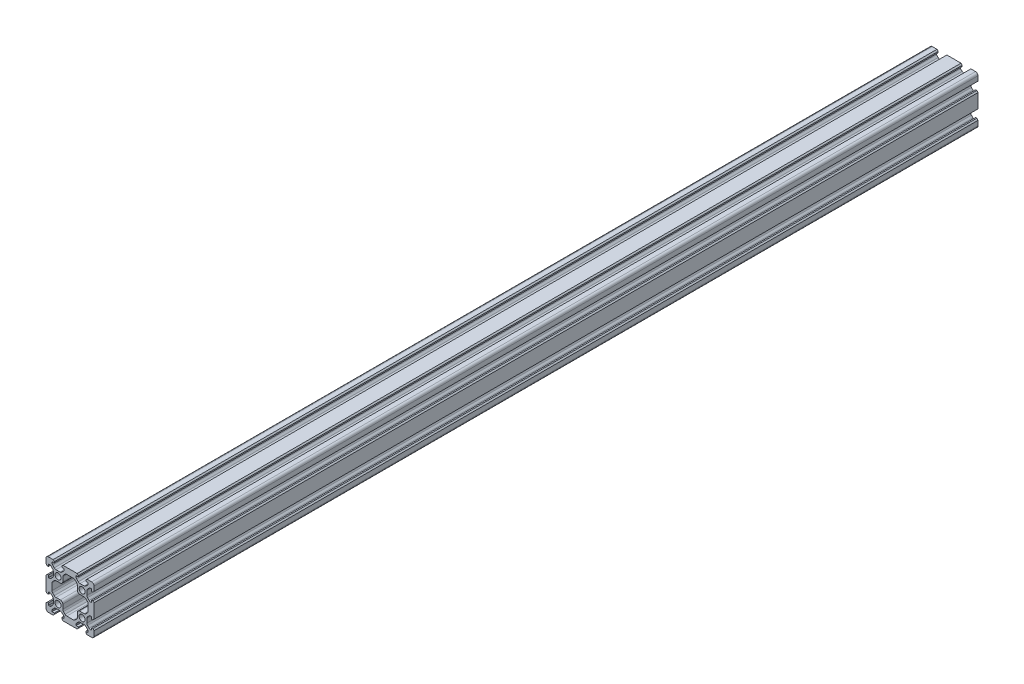
from build123d import *

# Parameters (mm, degrees)
SKETCH1_R           = 2.5
BOSS_EXTRUDE1_DEPTH = 735


with BuildPart() as part:
    # Sketch1 → Boss-Extrude1 (new body)
    with BuildSketch(Plane.XY):
        with BuildLine():
            Line((-13.1, -19), (-14.1, -20))
            Line((-14.1, -20), (-18, -20))
            ThreePointArc((-18, -20), (-19.414213562, -19.414213562), (-20, -18))
            Line((-20, -18), (-20, -14.1))
            Line((-20, -14.1), (-19, -13.1))
            Line((-19, -13.1), (-18, -13.1))
            Line((-18, -13.1), (-18, -15))
            Line((-18, -15), (-17.242640687, -15))
            ThreePointArc((-17.242640687, -15), (-16.477273822, -14.847759065), (-15.828427125, -14.414213562))
            Line((-15.828427125, -14.414213562), (-14.537854624, -13.123641061))
            ThreePointArc((-14.537854624, -13.123641061), (-14.104309121, -12.474794364), (-13.952068186, -11.709427499))
            Line((-13.952068186, -11.709427499), (-13.952068186, -8.290572501))
            ThreePointArc((-13.952068186, -8.290572501), (-14.104309121, -7.525205636), (-14.537854624, -6.876358939))
            Line((-14.537854624, -6.876358939), (-15.828427125, -5.585786438))
            ThreePointArc((-15.828427125, -5.585786438), (-16.477273822, -5.152240935), (-17.242640687, -5))
            Line((-17.242640687, -5), (-18, -5))
            Line((-18, -5), (-18, -6.9))
            Line((-18, -6.9), (-19, -6.9))
            Line((-19, -6.9), (-20, -5.9))
            Line((-20, -5.9), (-20, 5.9))
            Line((-20, 5.9), (-19, 6.9))
            Line((-19, 6.9), (-18, 6.9))
            Line((-18, 6.9), (-18, 5))
            Line((-18, 5), (-17.242640687, 5))
            ThreePointArc((-17.242640687, 5), (-16.477273822, 5.152240935), (-15.828427125, 5.585786438))
            Line((-15.828427125, 5.585786438), (-14.537854624, 6.876358939))
            ThreePointArc((-14.537854624, 6.876358939), (-14.104309121, 7.525205636), (-13.952068186, 8.290572501))
            Line((-13.952068186, 8.290572501), (-13.952068186, 11.709427499))
            ThreePointArc((-13.952068186, 11.709427499), (-14.104309121, 12.474794364), (-14.537854624, 13.123641061))
            Line((-14.537854624, 13.123641061), (-15.828427125, 14.414213562))
            ThreePointArc((-15.828427125, 14.414213562), (-16.477273822, 14.847759065), (-17.242640687, 15))
            Line((-17.242640687, 15), (-18, 15))
            Line((-18, 15), (-18, 13.1))
            Line((-18, 13.1), (-19, 13.1))
            Line((-19, 13.1), (-20, 14.1))
            Line((-20, 14.1), (-20, 18))
            ThreePointArc((-20, 18), (-19.414213562, 19.414213562), (-18, 20))
            Line((-18, 20), (-14.1, 20))
            Line((-14.1, 20), (-13.1, 19))
            Line((-13.1, 19), (-13.1, 18))
            Line((-13.1, 18), (-15, 18))
            Line((-15, 18), (-15, 17.242640687))
            ThreePointArc((-15, 17.242640687), (-14.847759065, 16.477273822), (-14.414213562, 15.828427125))
            Line((-14.414213562, 15.828427125), (-13.123641061, 14.537854624))
            ThreePointArc((-13.123641061, 14.537854624), (-12.474794364, 14.104309121), (-11.709427499, 13.952068186))
            Line((-11.709427499, 13.952068186), (-8.290572501, 13.952068186))
            ThreePointArc((-8.290572501, 13.952068186), (-7.525205636, 14.104309121), (-6.876358939, 14.537854624))
            Line((-6.876358939, 14.537854624), (-5.585786438, 15.828427125))
            ThreePointArc((-5.585786438, 15.828427125), (-5.152240935, 16.477273822), (-5, 17.242640687))
            Line((-5, 17.242640687), (-5, 18))
            Line((-5, 18), (-6.9, 18))
            Line((-6.9, 18), (-6.9, 19))
            Line((-6.9, 19), (-5.9, 20))
            Line((-5.9, 20), (5.9, 20))
            Line((5.9, 20), (6.9, 19))
            Line((6.9, 19), (6.9, 18))
            Line((6.9, 18), (5, 18))
            Line((5, 18), (5, 17.242640687))
            ThreePointArc((5, 17.242640687), (5.152240935, 16.477273822), (5.585786438, 15.828427125))
            Line((5.585786438, 15.828427125), (6.876358939, 14.537854624))
            ThreePointArc((6.876358939, 14.537854624), (7.525205636, 14.104309121), (8.290572501, 13.952068186))
            Line((8.290572501, 13.952068186), (11.709427499, 13.952068186))
            ThreePointArc((11.709427499, 13.952068186), (12.474794364, 14.104309121), (13.123641061, 14.537854624))
            Line((13.123641061, 14.537854624), (14.414213562, 15.828427125))
            ThreePointArc((14.414213562, 15.828427125), (14.847759065, 16.477273822), (15, 17.242640687))
            Line((15, 17.242640687), (15, 18))
            Line((15, 18), (13.1, 18))
            Line((13.1, 18), (13.1, 19))
            Line((13.1, 19), (14.1, 20))
            Line((14.1, 20), (18, 20))
            ThreePointArc((18, 20), (19.414213562, 19.414213562), (20, 18))
            Line((20, 18), (20, 14.1))
            Line((20, 14.1), (19, 13.1))
            Line((19, 13.1), (18, 13.1))
            Line((18, 13.1), (18, 15))
            Line((18, 15), (17.242640687, 15))
            ThreePointArc((17.242640687, 15), (16.477273822, 14.847759065), (15.828427125, 14.414213562))
            Line((15.828427125, 14.414213562), (14.537854624, 13.123641061))
            ThreePointArc((14.537854624, 13.123641061), (14.104309121, 12.474794364), (13.952068186, 11.709427499))
            Line((13.952068186, 11.709427499), (13.952068186, 8.290572501))
            ThreePointArc((13.952068186, 8.290572501), (14.104309121, 7.525205636), (14.537854624, 6.876358939))
            Line((14.537854624, 6.876358939), (15.828427125, 5.585786438))
            ThreePointArc((15.828427125, 5.585786438), (16.477273822, 5.152240935), (17.242640687, 5))
            Line((17.242640687, 5), (18, 5))
            Line((18, 5), (18, 6.9))
            Line((18, 6.9), (19, 6.9))
            Line((19, 6.9), (20, 5.9))
            Line((20, 5.9), (20, -5.9))
            Line((20, -5.9), (19, -6.9))
            Line((19, -6.9), (18, -6.9))
            Line((18, -6.9), (18, -5))
            Line((18, -5), (17.242640687, -5))
            ThreePointArc((17.242640687, -5), (16.477273822, -5.152240935), (15.828427125, -5.585786438))
            Line((15.828427125, -5.585786438), (14.537854624, -6.876358939))
            ThreePointArc((14.537854624, -6.876358939), (14.104309121, -7.525205636), (13.952068186, -8.290572501))
            Line((13.952068186, -8.290572501), (13.952068186, -11.709427499))
            ThreePointArc((13.952068186, -11.709427499), (14.104309121, -12.474794364), (14.537854624, -13.123641061))
            Line((14.537854624, -13.123641061), (15.828427125, -14.414213562))
            ThreePointArc((15.828427125, -14.414213562), (16.477273822, -14.847759065), (17.242640687, -15))
            Line((17.242640687, -15), (18, -15))
            Line((18, -15), (18, -13.1))
            Line((18, -13.1), (19, -13.1))
            Line((19, -13.1), (20, -14.1))
            Line((20, -14.1), (20, -18))
            ThreePointArc((20, -18), (19.414213562, -19.414213562), (18, -20))
            Line((18, -20), (14.1, -20))
            Line((14.1, -20), (13.1, -19))
            Line((13.1, -19), (13.1, -18))
            Line((13.1, -18), (15, -18))
            Line((15, -18), (15, -17.242640687))
            ThreePointArc((15, -17.242640687), (14.847759065, -16.477273822), (14.414213562, -15.828427125))
            Line((14.414213562, -15.828427125), (13.123641061, -14.537854624))
            ThreePointArc((13.123641061, -14.537854624), (12.474794364, -14.104309121), (11.709427499, -13.952068186))
            Line((11.709427499, -13.952068186), (8.290572501, -13.952068186))
            ThreePointArc((8.290572501, -13.952068186), (7.525205636, -14.104309121), (6.876358939, -14.537854624))
            Line((6.876358939, -14.537854624), (5.585786438, -15.828427125))
            ThreePointArc((5.585786438, -15.828427125), (5.152240935, -16.477273822), (5, -17.242640687))
            Line((5, -17.242640687), (5, -18))
            Line((5, -18), (6.9, -18))
            Line((6.9, -18), (6.9, -19))
            Line((6.9, -19), (5.9, -20))
            Line((5.9, -20), (-5.9, -20))
            Line((-5.9, -20), (-6.9, -19))
            Line((-6.9, -19), (-6.9, -18))
            Line((-6.9, -18), (-5, -18))
            Line((-5, -18), (-5, -17.242640687))
            ThreePointArc((-5, -17.242640687), (-5.152240935, -16.477273822), (-5.585786438, -15.828427125))
            Line((-5.585786438, -15.828427125), (-6.876358939, -14.537854624))
            ThreePointArc((-6.876358939, -14.537854624), (-7.525205636, -14.104309121), (-8.290572501, -13.952068186))
            Line((-8.290572501, -13.952068186), (-11.709427499, -13.952068186))
            ThreePointArc((-11.709427499, -13.952068186), (-12.474794364, -14.104309121), (-13.123641061, -14.537854624))
            Line((-13.123641061, -14.537854624), (-14.414213562, -15.828427125))
            ThreePointArc((-14.414213562, -15.828427125), (-14.847759065, -16.477273822), (-15, -17.242640687))
            Line((-15, -17.242640687), (-15, -18))
            Line((-15, -18), (-13.1, -18))
            Line((-13.1, -18), (-13.1, -19))
        make_face()
        with Locations((-10, -10)):
            Circle(SKETCH1_R, mode=Mode.SUBTRACT)
        with Locations((-10, 10)):
            Circle(SKETCH1_R, mode=Mode.SUBTRACT)
        with Locations((10, 10)):
            Circle(SKETCH1_R, mode=Mode.SUBTRACT)
        with Locations((10, -10)):
            Circle(SKETCH1_R, mode=Mode.SUBTRACT)
        with BuildLine():
            Line((-4.171572875, -14.414213562), (-5.462145376, -13.123641061))
            ThreePointArc((-5.462145376, -13.123641061), (-5.895690879, -12.474794364), (-6.047931814, -11.709427499))
            Line((-6.047931814, -11.709427499), (-6.047931814, -8.047931814))
            ThreePointArc((-6.047931814, -8.047931814), (-6.633718252, -6.633718252), (-8.047931814, -6.047931814))
            Line((-8.047931814, -6.047931814), (-11.709427499, -6.047931814))
            ThreePointArc((-11.709427499, -6.047931814), (-12.474794364, -5.895690879), (-13.123641061, -5.462145376))
            Line((-13.123641061, -5.462145376), (-14.414213562, -4.171572875))
            ThreePointArc((-14.414213562, -4.171572875), (-14.847759065, -3.522726178), (-15, -2.757359313))
            Line((-15, -2.757359313), (-15, 2.757359313))
            ThreePointArc((-15, 2.757359313), (-14.847759065, 3.522726178), (-14.414213562, 4.171572875))
            Line((-14.414213562, 4.171572875), (-13.123641061, 5.462145376))
            ThreePointArc((-13.123641061, 5.462145376), (-12.474794364, 5.895690879), (-11.709427499, 6.047931814))
            Line((-11.709427499, 6.047931814), (-8.047931814, 6.047931814))
            ThreePointArc((-8.047931814, 6.047931814), (-6.633718252, 6.633718252), (-6.047931814, 8.047931814))
            Line((-6.047931814, 8.047931814), (-6.047931814, 11.709427499))
            ThreePointArc((-6.047931814, 11.709427499), (-5.895690879, 12.474794364), (-5.462145376, 13.123641061))
            Line((-5.462145376, 13.123641061), (-4.171572875, 14.414213562))
            ThreePointArc((-4.171572875, 14.414213562), (-3.522726178, 14.847759065), (-2.757359313, 15))
            Line((-2.757359313, 15), (2.757359313, 15))
            ThreePointArc((2.757359313, 15), (3.522726178, 14.847759065), (4.171572875, 14.414213562))
            Line((4.171572875, 14.414213562), (5.462145376, 13.123641061))
            ThreePointArc((5.462145376, 13.123641061), (5.895690879, 12.474794364), (6.047931814, 11.709427499))
            Line((6.047931814, 11.709427499), (6.047931814, 8.047931814))
            ThreePointArc((6.047931814, 8.047931814), (6.633718252, 6.633718252), (8.047931814, 6.047931814))
            Line((8.047931814, 6.047931814), (11.709427499, 6.047931814))
            ThreePointArc((11.709427499, 6.047931814), (12.474794364, 5.895690879), (13.123641061, 5.462145376))
            Line((13.123641061, 5.462145376), (14.414213562, 4.171572875))
            ThreePointArc((14.414213562, 4.171572875), (14.847759065, 3.522726178), (15, 2.757359313))
            Line((15, 2.757359313), (15, -2.757359313))
            ThreePointArc((15, -2.757359313), (14.847759065, -3.522726178), (14.414213562, -4.171572875))
            Line((14.414213562, -4.171572875), (13.123641061, -5.462145376))
            ThreePointArc((13.123641061, -5.462145376), (12.474794364, -5.895690879), (11.709427499, -6.047931814))
            Line((11.709427499, -6.047931814), (8.047931814, -6.047931814))
            ThreePointArc((8.047931814, -6.047931814), (6.633718252, -6.633718252), (6.047931814, -8.047931814))
            Line((6.047931814, -8.047931814), (6.047931814, -11.709427499))
            ThreePointArc((6.047931814, -11.709427499), (5.895690879, -12.474794364), (5.462145376, -13.123641061))
            Line((5.462145376, -13.123641061), (4.171572875, -14.414213562))
            ThreePointArc((4.171572875, -14.414213562), (3.522726178, -14.847759065), (2.757359313, -15))
            Line((2.757359313, -15), (-2.757359313, -15))
            ThreePointArc((-2.757359313, -15), (-3.522726178, -14.847759065), (-4.171572875, -14.414213562))
        make_face(mode=Mode.SUBTRACT)
    extrude(amount=BOSS_EXTRUDE1_DEPTH)


solid = part.part
